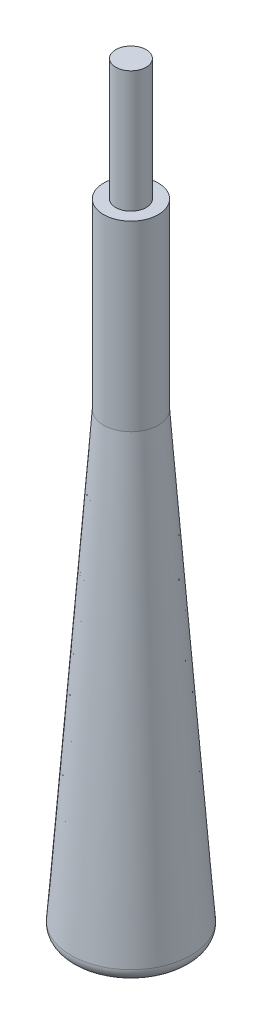
from build123d import *

# Parameters (mm, degrees)
SKETCH1_R           = 2.5
BOSS_EXTRUDE1_DEPTH = 20
SKETCH2_R           = 4.5
BOSS_EXTRUDE2_DEPTH = 30
FILLET1_R           = 2


with BuildPart() as part:
    # Sketch1 → Boss-Extrude1 (new body)
    with BuildSketch(Plane(origin=(0, 0, 0), x_dir=(1, 0, 0), z_dir=(0, 1, 0))):
        with Locations(Location((0, 0, 0), (0, 0, 270))):
            Circle(SKETCH1_R)
    extrude(amount=BOSS_EXTRUDE1_DEPTH)

    # Sketch2 → Boss-Extrude2 (add)
    with BuildSketch(Plane.XZ):
        with Locations(Location((0, 0, 0), (0, 0, 270))):
            Circle(SKETCH2_R)
    extrude(amount=BOSS_EXTRUDE2_DEPTH)

    # Sketch3 → Revolve1 (revolve)
    with BuildSketch(Plane.XY, mode=Mode.PRIVATE) as revolve1_sk:
        Polygon((10, -105), (4.5, -30), (2.5, -30), (7.25, -105), align=None)
    revolve(revolve1_sk.sketch.rotate(Axis((0, -30, 0), (0, -1, 0)), 270), axis=Axis((0, -30, 0), (0, -1, 0)))

    # Fillet1
    fillet1_edges = [part.edges().sort_by_distance(p)[0] for p in [
        (0, -105, 10),
    ]]
    fillet(fillet1_edges, radius=FILLET1_R)


solid = part.part
